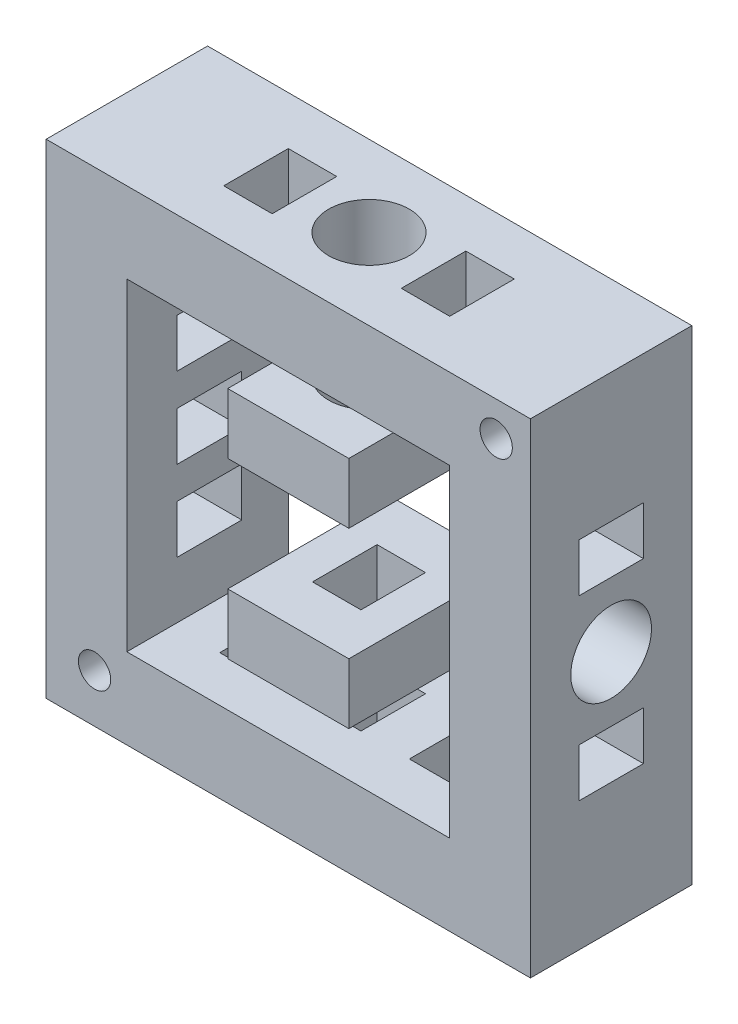
from build123d import *

# Parameters (mm, degrees)
SKETCH1_W             = 30
SKETCH1_H             = 30
BOSS_EXTRUDE1_DEPTH   = 10
SKETCH2_W             = 30
SKETCH2_H             = 30
SKETCH2_W_2           = 20
SKETCH2_H_2           = 20
BOSS_EXTRUDE2_DEPTH   = 10
SKETCH2_W_3           = 7.5
SKETCH2_H_3           = 3.748828889
BOSS_EXTRUDE2_2_DEPTH = 10
BOSS_EXTRUDE2_3_DEPTH = 10
SKETCH3_W             = 30
SKETCH3_H             = 30
BOSS_EXTRUDE3_DEPTH   = 10
SKETCH4_R             = 3.1
CUT_EXTRUDE1_DEPTH    = 10
SKETCH5_R             = 3.1
CUT_EXTRUDE2_DEPTH    = 10
CUT_EXTRUDE3_START    = -30
SKETCH8_R             = 1
CUT_EXTRUDE3_DEPTH    = 30
CUT_EXTRUDE5_START    = -11.5
SKETCH9_R             = 2.5
SKETCH9_W             = 3
SKETCH9_H             = 4
CUT_EXTRUDE5_DEPTH    = 11.5
SKETCH10_R            = 2.5
SKETCH10_W            = 4
SKETCH10_H            = 3
CUT_EXTRUDE6_DEPTH    = 10
SKETCH11_W            = 4
SKETCH11_H            = 3
CUT_EXTRUDE7_DEPTH    = 9
SKETCH13_W            = 3
SKETCH13_H            = 4
CUT_EXTRUDE9_DEPTH    = 13


with BuildPart() as part:
    # Sketch1 → Boss-Extrude1 (new body)
    with BuildSketch(Plane.XY):
        Rectangle(SKETCH1_W, SKETCH1_H)
    extrude(amount=BOSS_EXTRUDE1_DEPTH)

    # Sketch5 → Cut-Extrude2 (cut)
    with BuildSketch(Plane(origin=(0, 0, 0), x_dir=(-1, 0, 0), z_dir=(0, 0, -1))):
        with Locations((-6, -0.372899474)):
            Circle(SKETCH5_R)
    extrude(amount=-CUT_EXTRUDE2_DEPTH, mode=Mode.SUBTRACT)


with BuildPart() as body_2:
    # Sketch2 → Boss-Extrude2 (new body)
    with BuildSketch(Plane.XY.offset(10)):
        Rectangle(SKETCH2_W, SKETCH2_H)
        Rectangle(SKETCH2_W_2, SKETCH2_H_2, mode=Mode.SUBTRACT)
    extrude(amount=BOSS_EXTRUDE2_DEPTH)


with BuildPart() as body_3:
    # Sketch2 → Boss-Extrude2 2 (new body)
    with BuildSketch(Plane.XY.offset(10)):
        with Locations((0, 5.374414445)):
            Rectangle(SKETCH2_W_3, SKETCH2_H_3)
    extrude(amount=BOSS_EXTRUDE2_2_DEPTH)


with BuildPart() as body_4:
    # Sketch2 → Boss-Extrude2 3 (new body)
    with BuildSketch(Plane.XY.offset(10)):
        with Locations((0, -5.374414445)):
            Rectangle(SKETCH2_W_3, SKETCH2_H_3)
    extrude(amount=BOSS_EXTRUDE2_3_DEPTH)


with BuildPart() as body_5:
    # Sketch3 → Boss-Extrude3 (new body)
    with BuildSketch(Plane.XY.offset(20)):
        Rectangle(SKETCH3_W, SKETCH3_H)
    extrude(amount=BOSS_EXTRUDE3_DEPTH)

    # Sketch4 → Cut-Extrude1 (cut)
    with BuildSketch(Plane.XY.offset(30)):
        with Locations((-6, 0)):
            Circle(SKETCH4_R)
    extrude(amount=-CUT_EXTRUDE1_DEPTH, mode=Mode.SUBTRACT)


with BuildPart() as cut_extrude3_tool:
    # Sketch8 → Cut-Extrude3 (new body)
    with BuildSketch(Plane.XY.offset(30).offset(CUT_EXTRUDE3_START)):
        with Locations((-12, -12)):
            Circle(SKETCH8_R)
        with Locations((12.878679656, 12.878679656)):
            Circle(SKETCH8_R)
    extrude(amount=CUT_EXTRUDE3_DEPTH)


with BuildPart() as part_1:
    add(part.part)

    # Cut-Extrude3: cut by cut_extrude3_tool
    add(cut_extrude3_tool.part, mode=Mode.SUBTRACT)


with BuildPart() as body_2_1:
    add(body_2.part)

    # Cut-Extrude3: cut by cut_extrude3_tool
    add(cut_extrude3_tool.part, mode=Mode.SUBTRACT)


with BuildPart() as body_5_1:
    add(body_5.part)

    # Cut-Extrude3: cut by cut_extrude3_tool
    add(cut_extrude3_tool.part, mode=Mode.SUBTRACT)


with BuildPart() as cut_extrude5_tool:
    # Sketch9 → Cut-Extrude5 (new body)
    with BuildSketch(Plane(origin=(0, 15, 0), x_dir=(1, 0, 0), z_dir=(0, 1, 0)).offset(CUT_EXTRUDE5_START)):
        with Locations(Location((0, -15, 0), (0, 0, 270))):
            Circle(SKETCH9_R)
        with Locations((-5.5, -15)):
            Rectangle(SKETCH9_W, SKETCH9_H)
        with Locations((5.5, -15)):
            Rectangle(SKETCH9_W, SKETCH9_H)
    extrude(amount=CUT_EXTRUDE5_DEPTH)


with BuildPart() as body_2_2:
    add(body_2_1.part)

    # Cut-Extrude5: cut by cut_extrude5_tool
    add(cut_extrude5_tool.part, mode=Mode.SUBTRACT)

    # Sketch10 → Cut-Extrude6 (cut)
    with BuildSketch(Plane(origin=(15, 0, 0), x_dir=(0, 0, -1), z_dir=(1, 0, 0))):
        with Locations(Location((-15, 0, 0), (0, 0, 90))):
            Circle(SKETCH10_R)
        with Locations((-15, 5.5)):
            Rectangle(SKETCH10_W, SKETCH10_H)
        with Locations((-15, -5.5)):
            Rectangle(SKETCH10_W, SKETCH10_H)
    extrude(amount=-CUT_EXTRUDE6_DEPTH, mode=Mode.SUBTRACT)

    # Sketch11 → Cut-Extrude7 (cut)
    with BuildSketch(Plane.ZY.offset(15)):
        with Locations((14.883452823, 5)):
            Rectangle(SKETCH11_W, SKETCH11_H)
        with Locations((14.883452823, 0)):
            Rectangle(SKETCH11_W, SKETCH11_H)
        with Locations((14.883452823, -4.985769597)):
            Rectangle(SKETCH11_W, SKETCH11_H)
    extrude(amount=-CUT_EXTRUDE7_DEPTH, mode=Mode.SUBTRACT)


with BuildPart() as body_3_1:
    add(body_3.part)

    # Cut-Extrude5: cut by cut_extrude5_tool
    add(cut_extrude5_tool.part, mode=Mode.SUBTRACT)


with BuildPart() as cut_extrude9_tool:
    # Sketch13 → Cut-Extrude9 (new body)
    with BuildSketch(Plane.XZ.offset(15)):
        with Locations((0, 15)):
            Rectangle(SKETCH13_W, SKETCH13_H)
        with Locations((6, 15)):
            Rectangle(SKETCH13_W, SKETCH13_H)
        with Locations((-5.576653418, 15.166702073)):
            Rectangle(SKETCH13_W, SKETCH13_H)
    extrude(amount=-CUT_EXTRUDE9_DEPTH)


with BuildPart() as body_2_3:
    add(body_2_2.part)

    # Cut-Extrude9: cut by cut_extrude9_tool
    add(cut_extrude9_tool.part, mode=Mode.SUBTRACT)


with BuildPart() as body_4_1:
    add(body_4.part)

    # Cut-Extrude9: cut by cut_extrude9_tool
    add(cut_extrude9_tool.part, mode=Mode.SUBTRACT)


solid = Compound([body_3_1.part, body_2_3.part, body_4_1.part])
